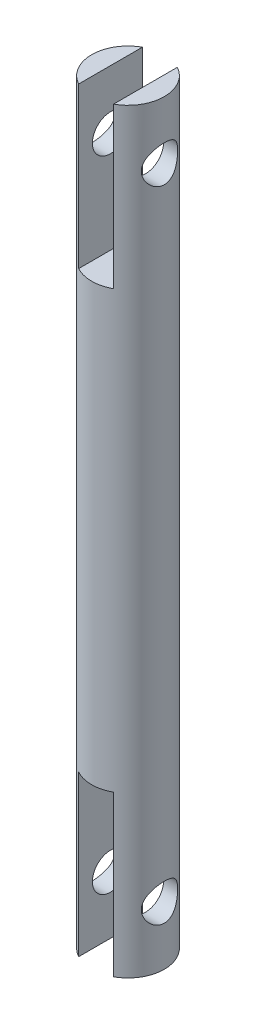
from build123d import *

# Parameters (mm, degrees)
SKETCH2_R               = 2.5
BOSS_EXTRUDE1_DEPTH     = 52
SKETCH3_W               = 2.4
SKETCH3_H               = 5
CUT_EXTRUDE1_DEPTH      = 11
CUT_EXTRUDE2_DEPTH      = 53.120053722
CUT_EXTRUDE2_DEPTH_BACK = 53.120053722
SKETCH4_R               = 1.25
SKETCH5_W               = 2.4
SKETCH5_H               = 5
CUT_EXTRUDE3_DEPTH      = 11


with BuildPart() as part:
    # Sketch2 → Boss-Extrude1 (new body)
    with BuildSketch(Plane(origin=(0, 0, 0), x_dir=(-1, 0, 0), z_dir=(0, 1, 0))):
        with Locations(Location((0, 0, 0), (0, 0, 270))):
            Circle(SKETCH2_R)
    extrude(amount=BOSS_EXTRUDE1_DEPTH)

    # Sketch3 → Cut-Extrude1 (cut)
    with BuildSketch(Plane.XZ):
        Rectangle(SKETCH3_W, SKETCH3_H)
    extrude(amount=-CUT_EXTRUDE1_DEPTH, mode=Mode.SUBTRACT)

    # Sketch4 → Cut-Extrude2 (cut, two sides: drawn at the far end of the back side and taken through both)
    with BuildSketch(Plane.YZ.offset(-CUT_EXTRUDE2_DEPTH_BACK)):
        with Locations(Location((4, 0, 0), (0, 0, 270))):
            Circle(SKETCH4_R)
        with Locations(Location((48, 0, 0), (0, 0, 270))):
            Circle(SKETCH4_R)
    extrude(amount=CUT_EXTRUDE2_DEPTH + CUT_EXTRUDE2_DEPTH_BACK, mode=Mode.SUBTRACT)

    # Sketch5 → Cut-Extrude3 (cut)
    with BuildSketch(Plane(origin=(0, 52, 0), x_dir=(-1, 0, 0), z_dir=(0, 1, 0))):
        Rectangle(SKETCH5_W, SKETCH5_H)
    extrude(amount=-CUT_EXTRUDE3_DEPTH, mode=Mode.SUBTRACT)


solid = part.part
